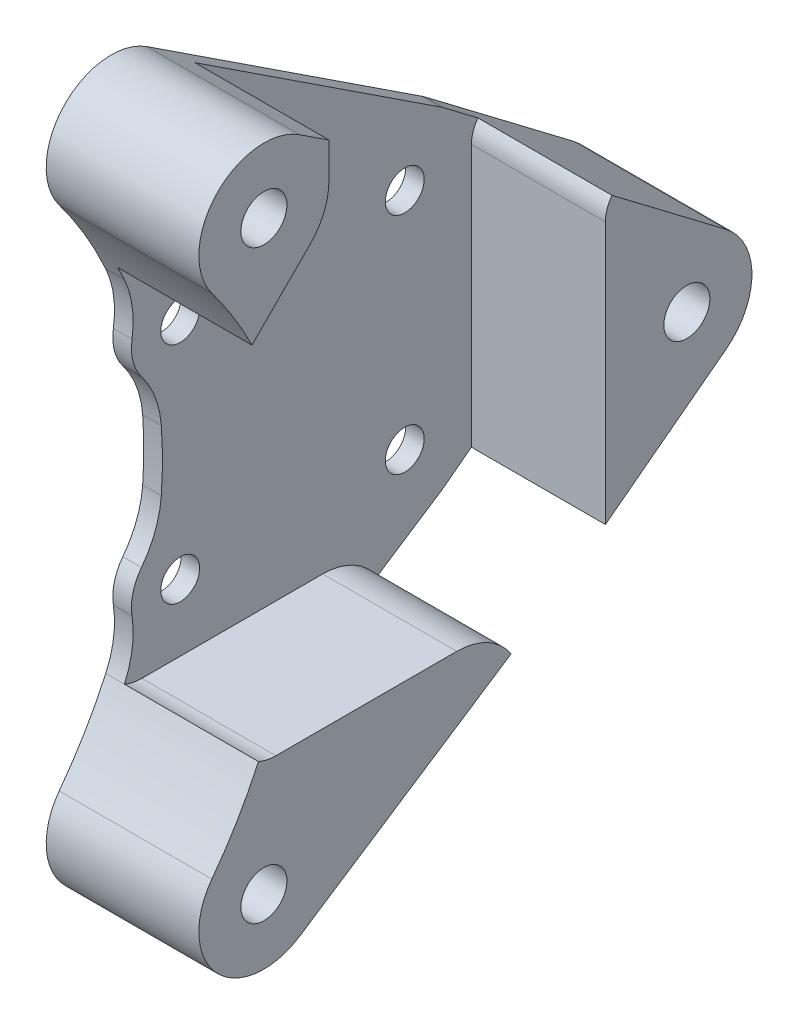
from build123d import *

# Parameters (mm, degrees)
BOSS_EXTRUDE1_DEPTH   = 14.90345
F_8_CLEARANCE_HOLE1_D = 4.4958
CUT_EXTRUDE1_START    = -13.084175
CUT_EXTRUDE1_DEPTH    = 13.084175
F_6_CLEARANCE_HOLE1_D = 3.7973


with BuildPart() as part:
    # Sketch1 → Boss-Extrude1 (new body)
    with BuildSketch(Plane(origin=(0, 0, 0), x_dir=(0, 0, -1), z_dir=(1, 0, 0))):
        with BuildLine():
            Line((-12.390427979, -33.883508061), (14.444672021, -16.268608061))
            ThreePointArc((14.444672021, -16.268608061), (14.622989145, -16.14717462), (14.797078303, -16.019753892))
            Line((14.797078303, -16.019753892), (29.249678303, -5.059653892))
            ThreePointArc((29.249678303, -5.059653892), (31.7627, 0), (29.249678303, 5.059653892))
            Line((29.249678303, 5.059653892), (14.797078303, 16.019753892))
            ThreePointArc((14.797078303, 16.019753892), (14.622989145, 16.14717462), (14.444672021, 16.268608061))
            Line((14.444672021, 16.268608061), (-12.390427979, 33.883508061))
            ThreePointArc((-12.390427979, 33.883508061), (-20.503514332, 32.92233885), (-20.955, 24.765))
            ThreePointArc((-20.955, 24.765), (-18.474577219, 21.05577373), (-16.409060049, 17.100461415))
            ThreePointArc((-16.409060049, 17.100461415), (-15.641722595, 14.450337743), (-15.666107705, 11.691467029))
            ThreePointArc((-15.666107705, 11.691467029), (-15.575146808, 9.784196429), (-14.742333624, 8.065948127))
            ThreePointArc((-14.742333624, 8.065948127), (-13.400723388, 5.655129962), (-12.806341132, 2.960937694))
            ThreePointArc((-12.806341132, 2.960937694), (-12.7, 0), (-12.806341132, -2.960937694))
            ThreePointArc((-12.806341132, -2.960937694), (-13.400723388, -5.655129962), (-14.742333624, -8.065948127))
            ThreePointArc((-14.742333624, -8.065948127), (-15.575146808, -9.784196429), (-15.666107705, -11.691467029))
            ThreePointArc((-15.666107705, -11.691467029), (-15.641722595, -14.450337743), (-16.409060049, -17.100461415))
            ThreePointArc((-16.409060049, -17.100461415), (-18.474577219, -21.05577373), (-20.955, -24.765))
            ThreePointArc((-20.955, -24.765), (-20.503514332, -32.92233885), (-12.390427979, -33.883508061))
        make_face()
    extrude(amount=BOSS_EXTRUDE1_DEPTH)

    # #8 Clearance Hole1 (through all)
    with Locations(Plane(origin=(14.90345, 0, 0), x_dir=(0, 0, -1), z_dir=(1, 0, 0))):
        with Locations((-15.875, -28.575), (-15.875, 28.575), (25.4127, 0)):
            Hole(F_8_CLEARANCE_HOLE1_D / 2)

    # Sketch4 → Cut-Extrude1 (cut)
    with BuildSketch(Plane(origin=(14.90345, 0, 0), x_dir=(0, 0, -1), z_dir=(1, 0, 0)).offset(CUT_EXTRUDE1_START)):
        with BuildLine():
            Line((2.952066637, -17.4625), (-14.703535363, -17.4625))
            ThreePointArc((-14.703535363, -17.4625), (-17.670883965, -16.233383965), (-18.9, -13.266035363))
            Line((-18.9, -13.266035363), (-18.9, 16.569743879))
            Line((-18.9, 16.569743879), (-11.384871939, 24.084871939))
            ThreePointArc((-11.384871939, 24.084871939), (-10.008364969, 26.144960204), (-9.525, 28.575))
            Line((-9.525, 28.575), (-9.525, 39.085699772))
            Line((-9.525, 39.085699772), (17.4625, 39.085699772))
            Line((17.4625, 39.085699772), (17.4625, 20.906374998))
            Line((17.4625, 20.906374998), (22.410286301, 14.224662488))
            ThreePointArc((22.410286301, 14.224662488), (19.145516673, 14.39328975), (17.4625, 11.590681902))
            Line((17.4625, 11.590681902), (17.4625, -17.4625))
            Line((17.4625, -17.4625), (7.616513377, -28.12126277))
            ThreePointArc((7.616513377, -28.12126277), (8.769417563, -21.266733278), (2.952066637, -17.4625))
        make_face()
    extrude(amount=CUT_EXTRUDE1_DEPTH, mode=Mode.SUBTRACT)

    # #6 Clearance Hole1 (through all)
    with Locations(Plane.ZY):
        with Locations((10.9601, -10.9601), (-10.9601, -10.9601), (-10.9601, 10.9601), (10.9601, 10.9601)):
            Hole(F_6_CLEARANCE_HOLE1_D / 2)


solid = part.part
